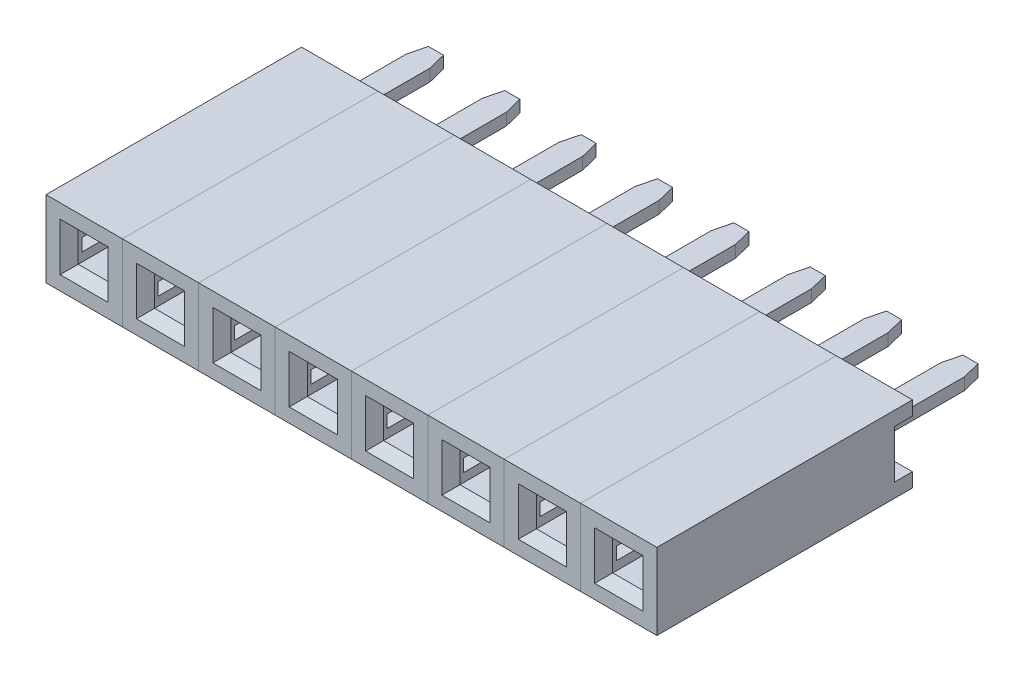
from build123d import *

# Parameters (mm, degrees)
SKETCH_1_W          = 2.54
SKETCH_1_H          = 2.54
EXTRUDE_1_DEPTH     = 8.5
SKETCH_2_W          = 2
SKETCH_2_H          = 0.42
CUT_EXTRUDE_1_DEPTH = 8.08
SKETCH_3_W          = 1
SKETCH_3_H          = 1
CUT_EXTRUDE_2_DEPTH = 6.5
SKETCH_4_W          = 0.6
SKETCH_4_H          = 1.6
CUT_EXTRUDE_3_DEPTH = 10.227849154
EXTRUDE_2_DEPTH     = 0.2
CHAMFER_1_SIZE      = 0.3
SKETCH1_W           = 0.8
SKETCH1_H           = 0.4
BOSS_EXTRUDE1_DEPTH = 3.2
CUT_EXTRUDE1_DEPTH  = 1
LPATTERN1_COUNT     = 8
LPATTERN1_PITCH     = 2.54


with BuildPart() as part:
    # Эскиз1 → Бобышка-Вытянуть1 (new body)
    with BuildSketch(Plane.XY):
        with Locations((0, 1.27)):
            Rectangle(SKETCH_1_W, SKETCH_1_H)
    extrude(amount=EXTRUDE_1_DEPTH)

    # Эскиз2 → Вырез-Вытянуть1 (cut)
    with BuildSketch(Plane(origin=(0, 0, 0), x_dir=(-1, 0, 0), z_dir=(0, 0, -1))):
        with Locations((0, 1.27)):
            Rectangle(SKETCH_2_W, SKETCH_2_H)
    extrude(amount=-CUT_EXTRUDE_1_DEPTH, mode=Mode.SUBTRACT)

    # Эскиз3 → Вырез-Вытянуть2 (cut)
    with BuildSketch(Plane.XY.offset(8.5)):
        with Locations((0, 1.27)):
            Rectangle(SKETCH_3_W, SKETCH_3_H)
    extrude(amount=-CUT_EXTRUDE_2_DEPTH, mode=Mode.SUBTRACT)

    # Эскиз4 → Вырез-Вытянуть3 (cut, through all)
    with BuildSketch(Plane.ZY.offset(1.27)):
        with Locations((0.3, 1.27)):
            Rectangle(SKETCH_4_W, SKETCH_4_H)
    extrude(amount=-CUT_EXTRUDE_3_DEPTH, mode=Mode.SUBTRACT)

    # Фаска1
    chamfer_1_edges = [part.edges().sort_by_distance(p)[0] for p in [
        (0.5, 1.27, 8.5),
        (0, 1.77, 8.5),
        (-0.5, 1.27, 8.5),
        (0, 0.77, 8.5),
    ]]
    chamfer(chamfer_1_edges, length=CHAMFER_1_SIZE)



with BuildPart() as body_2:
    # Эскиз6 → Бобышка-Вытянуть2 (new, symmetric)
    with BuildSketch(Plane(origin=(0, 1.27, 0), x_dir=(-1, 0, 0), z_dir=(0, -1, 0))):
        with BuildLine():
            Line((-0.4, 0), (0.4, 0))
            Line((0.4, 0), (0.4, -0.6))
            Line((0.4, -0.6), (0.6, -0.6))
            Line((0.6, -0.6), (1, -0.85))
            Line((1, -0.85), (1, -2.6))
            Line((1, -2.6), (0.813333333, -6.1))
            Line((0.813333333, -6.1), (0.45, -6.75))
            Line((0.45, -6.75), (0.3, -6.35))
            Line((0.3, -6.35), (0.5, -2.6))
            Line((0.5, -2.6), (0.5, -1.7))
            ThreePointArc((0.5, -1.7), (0, -1.2), (-0.5, -1.7))
            Line((-0.5, -1.7), (-0.5, -2.6))
            Line((-0.5, -2.6), (-0.3, -6.35))
            Line((-0.3, -6.35), (-0.45, -6.75))
            Line((-0.45, -6.75), (-0.813333333, -6.1))
            Line((-0.813333333, -6.1), (-1, -2.6))
            Line((-1, -2.6), (-1, -0.85))
            Line((-1, -0.85), (-0.6, -0.6))
            Line((-0.6, -0.6), (-0.4, -0.6))
            Line((-0.4, -0.6), (-0.4, 0))
        make_face()
    extrude(amount=EXTRUDE_2_DEPTH, both=True)


with BuildPart() as part_1:
    add(part.part)

    add(body_2.part)  # Boss-Extrude1 merges body 2
    # Sketch1 → Boss-Extrude1 (add)
    with BuildSketch(Plane(origin=(0, 0, 0), x_dir=(-1, 0, 0), z_dir=(0, 0, -1))):
        with Locations((0, 1.27)):
            Rectangle(SKETCH1_W, SKETCH1_H)
    extrude(amount=BOSS_EXTRUDE1_DEPTH)

    # Sketch2 → Cut-Extrude1 (cut)
    with BuildSketch(Plane(origin=(0, 1.47, 0), x_dir=(1, 0, 0), z_dir=(0, 1, 0))):
        Polygon((-0.4, 2.6), (-0.25, 3.2), (-0.4, 3.2), align=None)
        Polygon((0.4, 3.2), (0.25, 3.2), (0.4, 2.6), align=None)
        Polygon((0.25, 3.323331364), (0.25, 3.2), (0.4, 3.2), (0.4, 2.6), (0.533335502, 2.6), (0.533335502, 3.323331364), align=None)
        Polygon((-0.4, 3.2), (-0.25, 3.2), (-0.25, 3.209490078), (-0.25, 3.323331364), (-0.533335502, 3.323331364), (-0.533335502, 2.6), (-0.4, 2.6), align=None)
    extrude(amount=-CUT_EXTRUDE1_DEPTH, mode=Mode.SUBTRACT)


with BuildPart() as lpattern1_1:
    # LPattern1: pattern copy
    add(part_1.part.moved(Location(Vector(1, 0, 0) * (1 * LPATTERN1_PITCH))))


with BuildPart() as lpattern1_2:
    # LPattern1: pattern copy
    add(part_1.part.moved(Location(Vector(1, 0, 0) * (2 * LPATTERN1_PITCH))))


with BuildPart() as lpattern1_3:
    # LPattern1: pattern copy
    add(part_1.part.moved(Location(Vector(1, 0, 0) * (3 * LPATTERN1_PITCH))))


with BuildPart() as lpattern1_4:
    # LPattern1: pattern copy
    add(part_1.part.moved(Location(Vector(1, 0, 0) * (4 * LPATTERN1_PITCH))))


with BuildPart() as lpattern1_5:
    # LPattern1: pattern copy
    add(part_1.part.moved(Location(Vector(1, 0, 0) * (5 * LPATTERN1_PITCH))))


with BuildPart() as lpattern1_6:
    # LPattern1: pattern copy
    add(part_1.part.moved(Location(Vector(1, 0, 0) * (6 * LPATTERN1_PITCH))))


with BuildPart() as lpattern1_7:
    # LPattern1: pattern copy
    add(part_1.part.moved(Location(Vector(1, 0, 0) * (7 * LPATTERN1_PITCH))))


solid = Compound([part_1.part, lpattern1_1.part, lpattern1_2.part, lpattern1_3.part, lpattern1_4.part, lpattern1_5.part, lpattern1_6.part, lpattern1_7.part])
